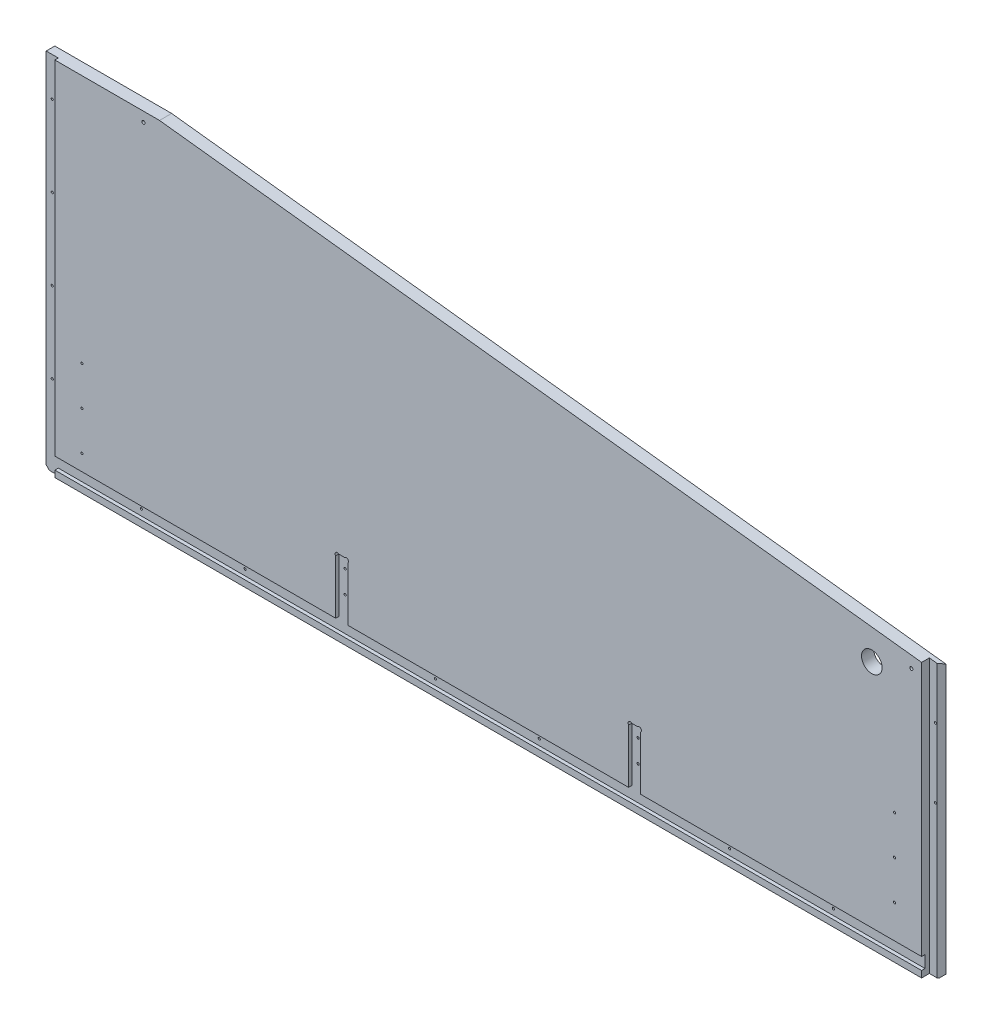
from build123d import *

# Parameters (mm, degrees)
EXTRUDE2_DEPTH     = 17.78
CUT_EXTRUDE3_DEPTH = 5.08
SKETCH9_R          = 3.174999999
CUT_EXTRUDE4_DEPTH = 5.08
SKETCH10_R         = 15.08125
SKETCH10_R_2       = 2.36855
SKETCH10_R_3       = 1.5875
CUT_EXTRUDE5_DEPTH = 17.78
SKETCH11_W         = 25.7175
SKETCH11_H         = 413.5501
CUT_EXTRUDE6_DEPTH = 11.43
CUT_EXTRUDE8_REACH = 10238.765


with BuildPart() as part:
    # Sketch7 → Extrude2 (new body)
    with BuildSketch(Plane.XY):
        Polygon((9086.320833334, -4722.091838581), (10222.970833334, -4853.78125), (10222.970833334, -5248.275), (10218.208333334, -5253.0375), (8919.633333334, -5253.0375), (8914.870833334, -5248.275), (8914.870833334, -4722.091838581), align=None)
    extrude(amount=-EXTRUDE2_DEPTH)

    # Sketch8 → Cut-Extrude3 (cut)
    with BuildSketch(Plane.XY):
        Polygon((8932.650833334, -4715.591300541), (8911.695833334, -4715.591300541), (8911.695833334, -5256.2125), (8932.650833334, -5256.2125), (8932.650833334, -5243.5125), (10226.145833334, -5243.5125), (10226.145833334, -5225.7325), (9792.864166667, -5225.7325), (9792.864166667, -5146.402628061), (9788.374038608, -5141.912499999), (9779.574294729, -5141.912499999), (9775.084166668, -5146.402628059), (9775.084166668, -5225.7325), (9362.757500002, -5225.7325), (9362.757500002, -5146.402628059), (9358.267371941, -5141.9125), (9349.467628062, -5141.9125), (9344.9775, -5146.402628059), (9344.9775, -5225.7325), (8932.650833334, -5225.7325), align=None)
    extrude(amount=-CUT_EXTRUDE3_DEPTH, mode=Mode.SUBTRACT)

    # Sketch9 → Cut-Extrude4 (cut)
    with BuildSketch(Plane.XY):
        with Locations((9347.22256403, -5144.157564029)):
            Circle(SKETCH9_R)
        with Locations((9360.512435972, -5144.157564029)):
            Circle(SKETCH9_R)
        with Locations((9777.329230699, -5144.157564029)):
            Circle(SKETCH9_R)
        with Locations((9790.619102638, -5144.157564029)):
            Circle(SKETCH9_R)
    extrude(amount=-CUT_EXTRUDE4_DEPTH, mode=Mode.SUBTRACT)

    # Sketch10 → Cut-Extrude5 (cut)
    with BuildSketch(Plane.XY):
        with Locations((10132.081036572, -4887.549352662)):
            Circle(SKETCH10_R)
        with Locations((9062.659822767, -4736.376540025)):
            Circle(SKETCH10_R_2)
        with Locations((8923.760833334, -4778.904166666)):
            Circle(SKETCH10_R_3)
        with Locations((8923.760833334, -4897.4375)):
            Circle(SKETCH10_R_3)
        with Locations((8923.760833334, -5015.970833334)):
            Circle(SKETCH10_R_3)
        with Locations((8923.760833334, -5134.504166666)):
            Circle(SKETCH10_R_3)
        with Locations((9054.570833334, -5234.6225)):
            Circle(SKETCH10_R_3)
        with Locations((9206.970833334, -5234.6225)):
            Circle(SKETCH10_R_3)
        with Locations((9353.8675, -5193.9825)):
            Circle(SKETCH10_R_3)
        with Locations((9353.8675, -5160.9625)):
            Circle(SKETCH10_R_3)
        with Locations((9486.370833334, -5234.6225)):
            Circle(SKETCH10_R_3)
        with Locations((9638.770833334, -5234.6225)):
            Circle(SKETCH10_R_3)
        with Locations((9783.974166666, -5193.9825)):
            Circle(SKETCH10_R_3)
        with Locations((9783.974166666, -5160.9625)):
            Circle(SKETCH10_R_3)
        with Locations((9918.170833334, -5234.6225)):
            Circle(SKETCH10_R_3)
        with Locations((10070.570833334, -5234.6225)):
            Circle(SKETCH10_R_3)
        with Locations((10214.080833334, -5031.58125)):
            Circle(SKETCH10_R_3)
        with Locations((10214.080833334, -4929.98125)):
            Circle(SKETCH10_R_3)
        with Locations((10190.180218809, -4867.008218481)):
            Circle(SKETCH10_R_2)
        with Locations((8972.338333334, -5087.9375)):
            Circle(SKETCH10_R_3)
        with Locations((8972.338333334, -5145.0875)):
            Circle(SKETCH10_R_3)
        with Locations((8972.338333334, -5202.2375)):
            Circle(SKETCH10_R_3)
        with Locations((10165.503333334, -5176.8375)):
            Circle(SKETCH10_R_3)
        with Locations((10165.503333334, -5119.6875)):
            Circle(SKETCH10_R_3)
        with Locations((10165.503333334, -5062.5375)):
            Circle(SKETCH10_R_3)
    extrude(amount=-CUT_EXTRUDE5_DEPTH, mode=Mode.SUBTRACT)

    # Sketch11 → Cut-Extrude6 (cut)
    with BuildSketch(Plane.XY):
        with Locations((10218.049583334, -5051.02495)):
            Rectangle(SKETCH11_W, SKETCH11_H)
    extrude(amount=-CUT_EXTRUDE6_DEPTH, mode=Mode.SUBTRACT)

    # Cut-Extrude8: up to this plane
    cut_extrude8_end = Plane(origin=(9086.320833334, -4722.091838581, -17.78), z_dir=(0.11508765240352697, 0.993355340381399, 0))
    # Sketch14 → Cut-Extrude8 (cut, up to the surface)
    with BuildSketch(Plane.XZ.offset(5253.0375), mode=Mode.PRIVATE) as cut_extrude8_sk1:
        Polygon((10222.970833334, -11.43), (10229.320833334, -11.43), (10222.970833334, -17.78), (10216.620833334, -11.43), align=None)
    cut_extrude8_tool1 = split(extrude(cut_extrude8_sk1.sketch, amount=-CUT_EXTRUDE8_REACH, mode=Mode.PRIVATE), bisect_by=cut_extrude8_end, keep=Keep.BOTH, mode=Mode.PRIVATE)
    add(cut_extrude8_tool1.solids().sort_by_distance((10222.970833, -5253.0375, -13.546667))[0], mode=Mode.SUBTRACT)


solid = part.part
